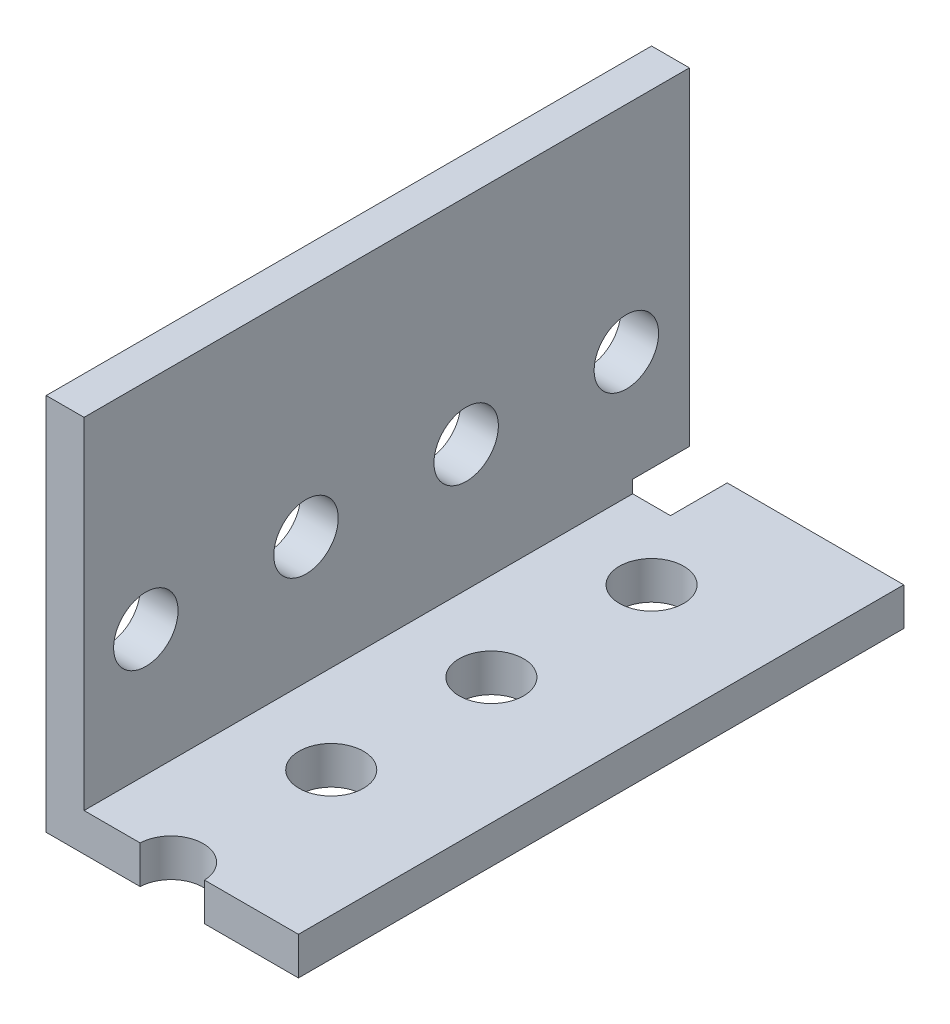
from build123d import *

# Parameters (mm, degrees)
SKETCH_1_W          = 3
SKETCH_1_H          = 27
SKETCH_1_H_2        = 3
SKETCH_1_W_2        = 17
EXTRUDE_1_DEPTH     = 48
SKETCH_2_R          = 2.555
CUT_EXTRUDE_1_DEPTH = 59.096901811
SKETCH_3_R          = 2.555
CUT_EXTRUDE_2_DEPTH = 55.120236511
SKETCH_4_W          = 6
SKETCH_4_H          = 4
CUT_EXTRUDE_3_DEPTH = 4.5


with BuildPart() as part:
    # 草图1 → 凸台-拉伸1 (new body)
    with BuildSketch(Plane.XY):
        with Locations((0, 1.5)):
            Rectangle(SKETCH_1_W, SKETCH_1_H)
        with Locations((0, -13.5)):
            Rectangle(SKETCH_1_W, SKETCH_1_H_2)
        with Locations((10, -13.5)):
            Rectangle(SKETCH_1_W_2, SKETCH_1_H_2)
    extrude(amount=EXTRUDE_1_DEPTH)

    # 草图2 → 切除-拉伸1 (cut, through all)
    with BuildSketch(Plane(origin=(0, -12, 0), x_dir=(1, 0, 0), z_dir=(0, 1, 0))):
        with Locations(Location((8.5, -10, 0), (0, 0, 270))):
            Circle(SKETCH_2_R)
        with Locations(Location((8.5, -22.7, 0), (0, 0, 270))):
            Circle(SKETCH_2_R)
        with Locations(Location((8.5, -35.4, 0), (0, 0, 270))):
            Circle(SKETCH_2_R)
        with Locations((8.5, -48.1)):
            Circle(SKETCH_2_R)
        with Locations((8.5, -60.8)):
            Circle(SKETCH_2_R)
    extrude(amount=-CUT_EXTRUDE_1_DEPTH, mode=Mode.SUBTRACT)

    # 草图3 → 切除-拉伸2 (cut, through all)
    with BuildSketch(Plane.ZY.offset(1.5)):
        with Locations(Location((5, -2, 0), (0, 0, 270))):
            Circle(SKETCH_3_R)
        with Locations(Location((17.7, -2, 0), (0, 0, 270))):
            Circle(SKETCH_3_R)
        with Locations(Location((30.4, -2, 0), (0, 0, 270))):
            Circle(SKETCH_3_R)
        with Locations(Location((43.1, -2, 0), (0, 0, 270))):
            Circle(SKETCH_3_R)
        with Locations((55.8, -2)):
            Circle(SKETCH_3_R)
    extrude(amount=-CUT_EXTRUDE_2_DEPTH, mode=Mode.SUBTRACT)

    # 草图4 → 切除-拉伸3 (cut)
    with BuildSketch(Plane(origin=(0, 0, 0), x_dir=(-1, 0, 0), z_dir=(0, 0, -1))):
        with Locations((-1.5, -13)):
            Rectangle(SKETCH_4_W, SKETCH_4_H)
    extrude(amount=-CUT_EXTRUDE_3_DEPTH, mode=Mode.SUBTRACT)


solid = part.part
